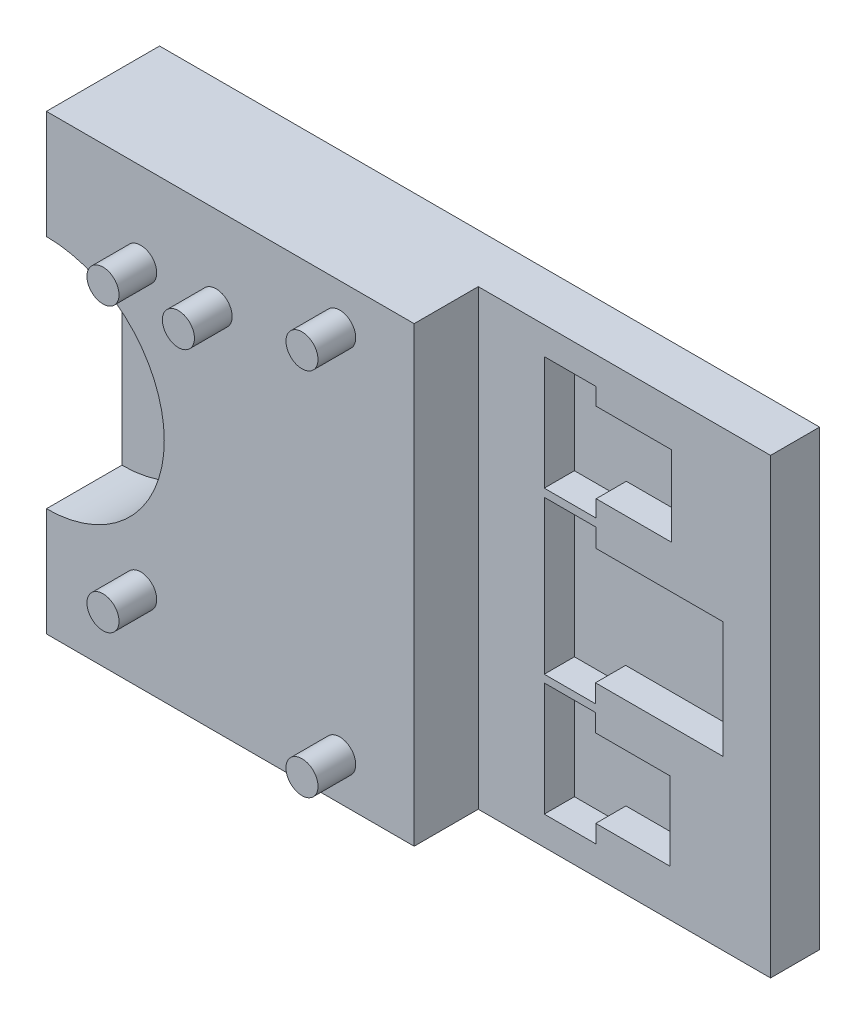
from build123d import *

# Parameters (mm, degrees)
SKETCH1_W           = 44.45
SKETCH1_H           = 30.48
BOSS_EXTRUDE1_DEPTH = 7.62
SKETCH2_R           = 1.0795
BOSS_EXTRUDE2_DEPTH = 2.54
SKETCH3_R           = 7.9375
CUT_EXTRUDE1_DEPTH  = 5.08
SKETCH4_W           = 15.24
SKETCH4_H           = 30.48
CUT_EXTRUDE2_DEPTH  = 6.35
SKETCH5_W           = 4.445
SKETCH5_H           = 30.48
CUT_EXTRUDE3_DEPTH  = 4.318
BOSS_EXTRUDE3_DEPTH = 2.032


with BuildPart() as part:
    # Sketch1 → Boss-Extrude1 (new body)
    with BuildSketch(Plane.XY):
        with Locations((22.225, 15.24)):
            Rectangle(SKETCH1_W, SKETCH1_H)
    extrude(amount=BOSS_EXTRUDE1_DEPTH)

    # Sketch2 → Boss-Extrude2 (add)
    with BuildSketch(Plane.XY.offset(7.62)):
        with Locations(Location((6.35, 24.765, 0), (0, 0, 180))):
            Circle(SKETCH2_R)
        with Locations(Location((6.35, 5.715, 0), (0, 0, 180))):
            Circle(SKETCH2_R)
        with Locations(Location((11.43, 24.765, 0), (0, 0, 180))):
            Circle(SKETCH2_R)
        with Locations(Location((19.7513587, 27.686, 0), (0, 0, 180))):
            Circle(SKETCH2_R)
        with Locations(Location((19.7513587, 2.794, 0), (0, 0, 180))):
            Circle(SKETCH2_R)
    extrude(amount=BOSS_EXTRUDE2_DEPTH)

    # Sketch3 → Cut-Extrude1 (cut)
    with BuildSketch(Plane.XY.offset(7.62)):
        with Locations((0, 15.24)):
            Circle(SKETCH3_R)
    extrude(amount=-CUT_EXTRUDE1_DEPTH, mode=Mode.SUBTRACT)

    # Sketch4 → Cut-Extrude2 (cut)
    with BuildSketch(Plane.XY.offset(7.62)):
        with Locations((36.83, 15.24)):
            Rectangle(SKETCH4_W, SKETCH4_H)
    extrude(amount=-CUT_EXTRUDE2_DEPTH, mode=Mode.SUBTRACT)

    # Sketch5 → Cut-Extrude3 (cut)
    with BuildSketch(Plane.XY.offset(7.62)):
        with Locations((26.9875, 15.24)):
            Rectangle(SKETCH5_W, SKETCH5_H)
    extrude(amount=-CUT_EXTRUDE3_DEPTH, mode=Mode.SUBTRACT)

    # Sketch6 → Boss-Extrude3 (add)
    with BuildSketch(Plane.XY.offset(1.27)):
        Polygon((29.21, 0), (29.21, 1.93778588), (32.678761959, 1.93778588), (32.678761959, 3.133507731), (37.686930292, 3.133507731), (37.686930292, 8.402137785), (32.658263267, 8.402137785), (32.658263267, 9.590598202), (29.21, 9.590598202), (29.21, 10.097072894), (32.658263267, 10.097072894), (32.658263267, 11.322249124), (41.237467305, 11.322249124), (41.237467305, 19.177308186), (32.703717585, 19.177308186), (32.703717585, 20.417489762), (29.21, 20.417489762), (29.21, 20.9492523), (32.703717585, 20.9492523), (32.703717585, 22.079298556), (37.771400605, 22.079298556), (37.771400605, 27.473279734), (32.702551474, 27.473279734), (32.702551474, 28.622642458), (29.21, 28.622642458), (29.21, 30.48), (44.45, 30.48), (44.45, 0), align=None)
    extrude(amount=BOSS_EXTRUDE3_DEPTH)


solid = part.part
